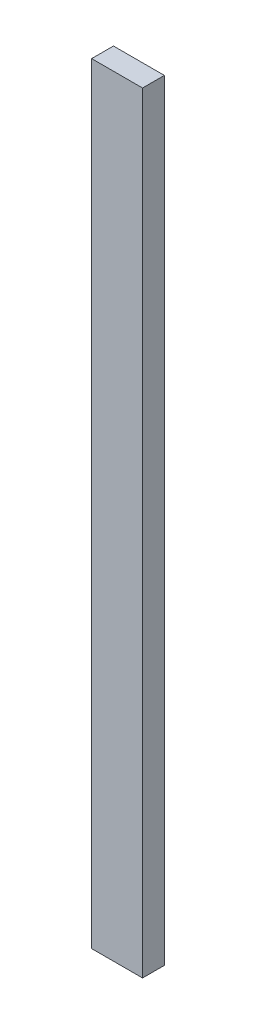
from build123d import *

# Parameters (mm, degrees)
SKETCH1_W           = 88.9
SKETCH1_H           = 38.1
BOSS_EXTRUDE1_DEPTH = 1346.2


with BuildPart() as part:
    # Sketch1 → Boss-Extrude1 (new body)
    with BuildSketch(Plane(origin=(0, 0, 0), x_dir=(1, 0, 0), z_dir=(0, 1, 0))):
        Rectangle(SKETCH1_W, SKETCH1_H)
    extrude(amount=BOSS_EXTRUDE1_DEPTH)


solid = part.part
